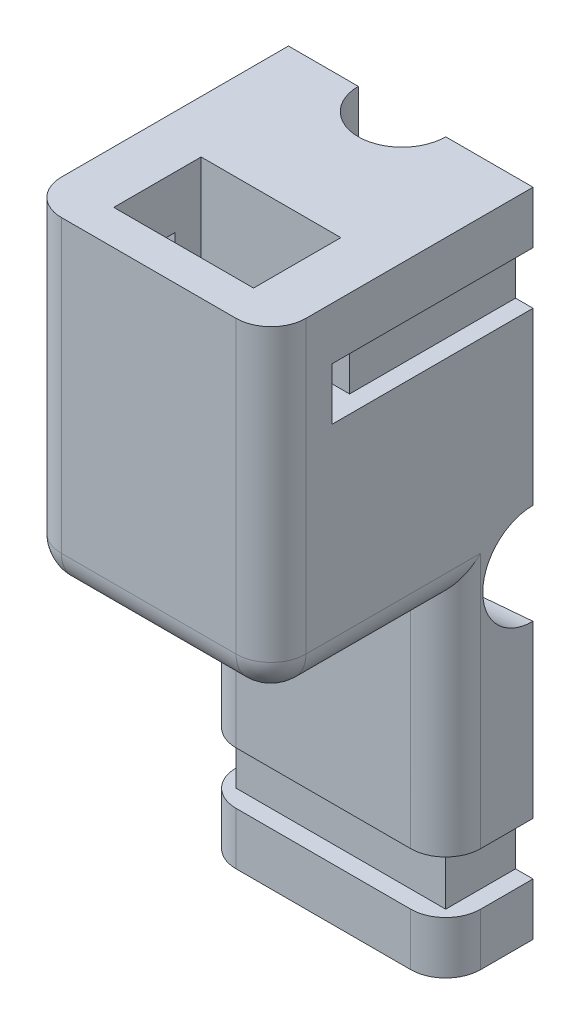
from build123d import *

# Parameters (mm, degrees)
CROQUIS2_W              = 14
CROQUIS2_H              = 37.290106074
SALIENTE_EXTRUIR1_DEPTH = 5
CROQUIS6_W              = 14
CROQUIS6_H              = 18.645053037
SALIENTE_EXTRUIR2_DEPTH = 10
CROQUIS4_W              = 1
CROQUIS4_H              = 3
CORTAR_EXTRUIR2_DEPTH   = 9.5
CORTAR_EXTRUIR3_START   = -13
CROQUIS5_W              = 2
CROQUIS5_H              = 3
CROQUIS5_W_2            = 3.958309594
CORTAR_EXTRUIR3_DEPTH   = 14
CROQUIS7_W              = 8
CROQUIS7_H              = 5
CORTAR_EXTRUIR4_DEPTH   = 15
REDONDEO1_R             = 2


with BuildPart() as part:
    # Croquis2 → Saliente-Extruir1 (new body)
    with BuildSketch(Plane.XY):
        with Locations((0.5, 0)):
            Rectangle(CROQUIS2_W, CROQUIS2_H)
    extrude(amount=SALIENTE_EXTRUIR1_DEPTH)

    # Croquis2<4> → Cortar-Revolución1 (revolve, cut)
    with BuildSketch(Plane.XY):
        Polygon((-2.5, -18.645053037), (0, -18.645053037), (0, 18.645053037), (-2.5, 18.645053037), (-2.5, 9.645053037), (-3.5, 7), (-3.5, -7), (-2.5, -9.645053037), align=None)
    revolve(axis=Axis((0, 7, 0), (0, 1, 0)), mode=Mode.SUBTRACT)

    # Croquis3 → Cortar-Revolución2 (revolve, cut)
    with BuildSketch(Plane(origin=(0, 0, 0), x_dir=(-1, 0, 0), z_dir=(0, 0, -1))):
        Polygon((0, 0), (0, 3.5), (-12, 2.5), (-12, 0), align=None)
    revolve(axis=Axis((0, 0, 0), (1, 0, 0)), mode=Mode.SUBTRACT)

    # Croquis6 → Saliente-Extruir2 (add)
    with BuildSketch(Plane.XY.offset(5)):
        with Locations((0.5, 9.322526519)):
            Rectangle(CROQUIS6_W, CROQUIS6_H)
    extrude(amount=SALIENTE_EXTRUIR2_DEPTH)

    # Croquis4 → Cortar-Extruir2 (cut)
    with BuildSketch(Plane(origin=(0, 0, 0), x_dir=(-1, 0, 0), z_dir=(0, 0, -1))):
        with Locations((-7, 14.145053037)):
            Rectangle(CROQUIS4_W, CROQUIS4_H)
        with Locations((6, 14.145053037)):
            Rectangle(CROQUIS4_W, CROQUIS4_H)
        with Locations((6, -14.145053037)):
            Rectangle(CROQUIS4_W, CROQUIS4_H)
        with Locations((-7, -14.145053037)):
            Rectangle(CROQUIS4_W, CROQUIS4_H)
    extrude(amount=-CORTAR_EXTRUIR2_DEPTH, mode=Mode.SUBTRACT)

    # Croquis5 → Cortar-Extruir3 (cut)
    with BuildSketch(Plane(origin=(6.5, 0, 0), x_dir=(0, 0, -1), z_dir=(1, 0, 0)).offset(CORTAR_EXTRUIR3_START)):
        with Locations((-10.5, 14.145053037)):
            Rectangle(CROQUIS5_W, CROQUIS5_H)
        with Locations((-5.979154797, -14.145053037)):
            Rectangle(CROQUIS5_W_2, CROQUIS5_H)
    extrude(amount=CORTAR_EXTRUIR3_DEPTH, mode=Mode.SUBTRACT)

    # Croquis7 → Cortar-Extruir4 (cut)
    with BuildSketch(Plane(origin=(0, 18.645053037, 0), x_dir=(1, 0, 0), z_dir=(0, 1, 0))):
        with Locations((0.5, -10.5)):
            Rectangle(CROQUIS7_W, CROQUIS7_H)
    extrude(amount=-CORTAR_EXTRUIR4_DEPTH, mode=Mode.SUBTRACT)

    # Redondeo1
    redondeo1_edges = [part.edges().sort_by_distance(p)[0] for p in [
        (-6.5, -6.322526519, 5),
        (7.5, -6.322526519, 5),
        (7.5, 0, 10),
        (-6.5, 0, 10),
        (7.5, 9.322526519, 15),
        (-6.5, 9.322526519, 15),
        (0.5, 0, 15),
        (7.5, -17.145053037, 5),
        (-6.5, -17.145053037, 5),
    ]]
    fillet(redondeo1_edges, radius=REDONDEO1_R)


solid = part.part
